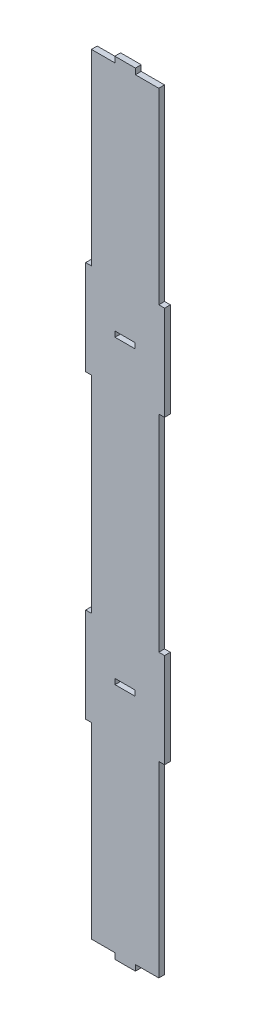
from build123d import *

# Parameters (mm, degrees)
SKETCH2_W           = 15
SKETCH2_H           = 4
BOSS_EXTRUDE1_DEPTH = 4.3


with BuildPart() as part:
    # Sketch2 → Boss-Extrude1 (new body)
    with BuildSketch(Plane.XY):
        Polygon((-25, -286), (-7.65, -286), (-7.65, -290.3), (7.65, -290.3), (7.65, -286), (25, -286), (25, -146.7666), (29.3, -146.7666), (29.3, -76.5666), (25, -76.5666), (25, 76.5667), (29.3, 76.5667), (29.3, 146.7667), (25, 146.7667), (25, 286), (7.65, 286), (7.65, 290.3), (-7.65, 290.3), (-7.65, 286), (-25, 286), (-25, 146.7667), (-29.3, 146.7667), (-29.3, 76.5667), (-25, 76.5667), (-25, -76.5666), (-29.3, -76.5666), (-29.3, -146.7666), (-25, -146.7666), align=None)
        with Locations((0, 111.6666)):
            Rectangle(SKETCH2_W, SKETCH2_H, mode=Mode.SUBTRACT)
        with Locations((0, -111.6666)):
            Rectangle(SKETCH2_W, SKETCH2_H, mode=Mode.SUBTRACT)
    extrude(amount=BOSS_EXTRUDE1_DEPTH)


solid = part.part
